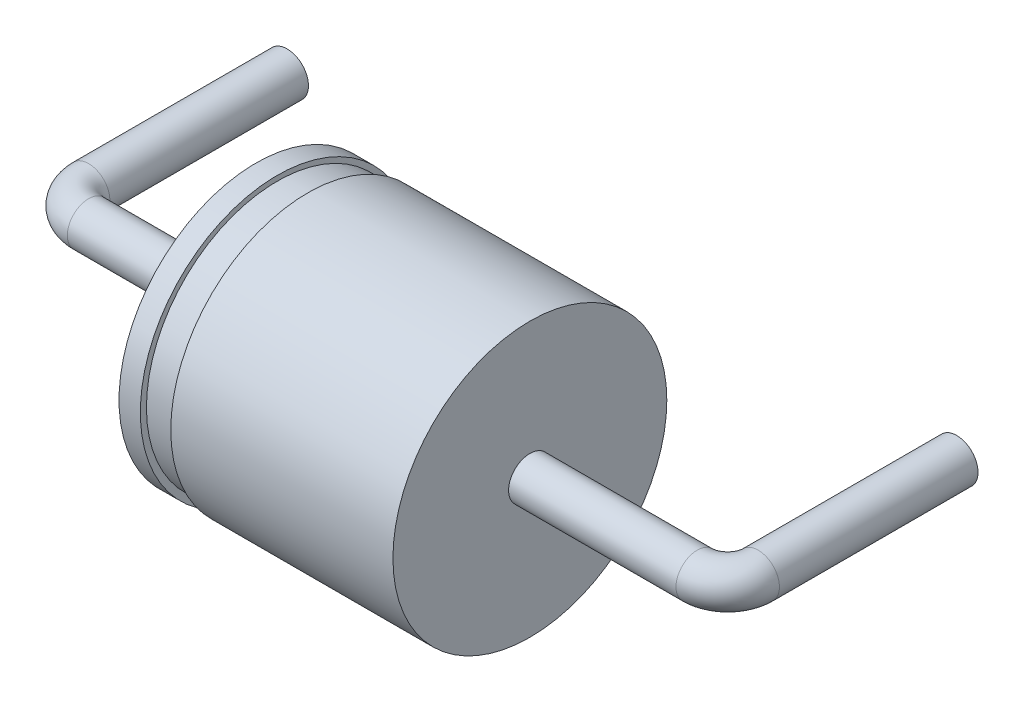
from build123d import *

# Parameters (mm, degrees)
SKETCH_3_R        = 4.5
EXTRUDE_1_DEPTH   = 9
SKETCH_4_W        = 1
SKETCH_4_H        = 0.3
SKETCH_6_R        = 0.7
EXTRUDE_2_DEPTH   = 6
EXTRUDE_2_2_DEPTH = 6
SKETCH_7_R        = 0.7


with BuildPart() as part:
    # Эскиз3 → Вытянуть1 (new body)
    with BuildSketch(Plane(origin=(6.5, 0, 0), x_dir=(0, 0, -1), z_dir=(1, 0, 0))):
        with Locations((-1.525, -0.033649265)):
            Circle(SKETCH_3_R)
    extrude(amount=EXTRUDE_1_DEPTH)

    # Эскиз4 → Вырез-Повернуть1 (revolve, cut)
    with BuildSketch(Plane(origin=(0, 0, 0), x_dir=(1, 0, 0), z_dir=(0, 1, 0)), mode=Mode.PRIVATE) as cut_revolve_1_sk:
        with Locations((7.7, 2.925)):
            Rectangle(SKETCH_4_W, SKETCH_4_H)
    revolve(cut_revolve_1_sk.sketch.rotate(Axis((0, 0, 1.525), (1, 0, 0)), 180), axis=Axis((0, 0, 1.525), (1, 0, 0)), mode=Mode.SUBTRACT)



with BuildPart() as body_2:
    # Эскиз6 → Вытянуть2 (new body)
    with BuildSketch(Plane.XY):
        Circle(SKETCH_6_R)
    extrude(amount=-EXTRUDE_2_DEPTH)


with BuildPart() as body_3:
    # Эскиз6 → Extrude 2 2 (new body)
    with BuildSketch(Plane.XY):
        with Locations(Location((22, 0, 0), (0, 0, 180))):
            Circle(SKETCH_6_R)
    extrude(amount=-EXTRUDE_2_2_DEPTH)


with BuildPart() as part_1:
    add(part.part)

    add(body_2.part)  # По траектории1 merges body 2

    add(body_3.part)  # По траектории1 merges body 3
    # По траектории1: sweep along a path in Эскиз5
    with BuildLine(Plane(origin=(0, 0, 0), x_dir=(1, 0, 0), z_dir=(0, 1, 0))) as sweep_1_path:
        Line((0, 0), (0, -0.525))
        ThreePointArc((0, -0.525), (0.292893219, -1.232106781), (1, -1.525))
        Line((1, -1.525), (6.8, -1.525))
        Line((6.8, -1.525), (21, -1.525))
        ThreePointArc((21, -1.525), (21.707106781, -1.232106781), (22, -0.525))
        Line((22, -0.525), (22, 0))
    # Эскиз7 → По траектории1 (sweep)
    with BuildSketch(Plane.XY):
        Circle(SKETCH_7_R)
    sweep(path=sweep_1_path.line)


solid = part_1.part
